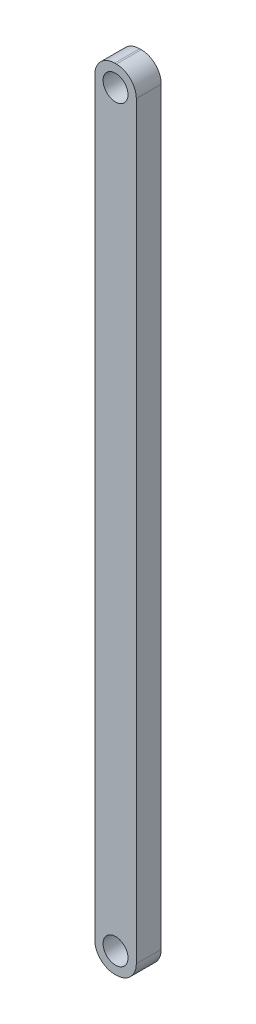
from build123d import *

# Parameters (mm, degrees)
SKETCH2_W           = 6.35
SKETCH2_H           = 120.65
BOSS_EXTRUDE1_DEPTH = 3.81
EDGE_1_R            = 3.048
EDGE_2_R            = 3.048
EDGE_3_R            = 3.048
EDGE_4_R            = 3.048
SKETCH4_R           = 1.905
HOLES_DEPTH         = 121.877049517


with BuildPart() as part:
    # Sketch2 → Boss-Extrude1 (new body)
    with BuildSketch(Plane.XY):
        with Locations((3.175, 60.325)):
            Rectangle(SKETCH2_W, SKETCH2_H)
    extrude(amount=BOSS_EXTRUDE1_DEPTH)

    # Edge 1
    edge_1_edges = [part.edges().sort_by_distance(p)[0] for p in [
        (6.35, 120.65, 1.905),
    ]]
    fillet(edge_1_edges, radius=EDGE_1_R)

    # Edge 2
    edge_2_edges = [part.edges().sort_by_distance(p)[0] for p in [
        (0, 120.65, 1.905),
    ]]
    fillet(edge_2_edges, radius=EDGE_2_R)

    # Edge 3
    edge_3_edges = [part.edges().sort_by_distance(p)[0] for p in [
        (6.35, 0, 1.905),
    ]]
    fillet(edge_3_edges, radius=EDGE_3_R)

    # Edge 4
    edge_4_edges = [part.edges().sort_by_distance(p)[0] for p in [
        (0, 0, 1.905),
    ]]
    fillet(edge_4_edges, radius=EDGE_4_R)

    # Sketch4 → Holes (cut, through all)
    with BuildSketch(Plane.XY.offset(3.81)):
        with Locations((3.175, 3.175)):
            Circle(SKETCH4_R)
        with Locations((3.175, 117.475)):
            Circle(SKETCH4_R)
    extrude(amount=-HOLES_DEPTH, mode=Mode.SUBTRACT)


solid = part.part
